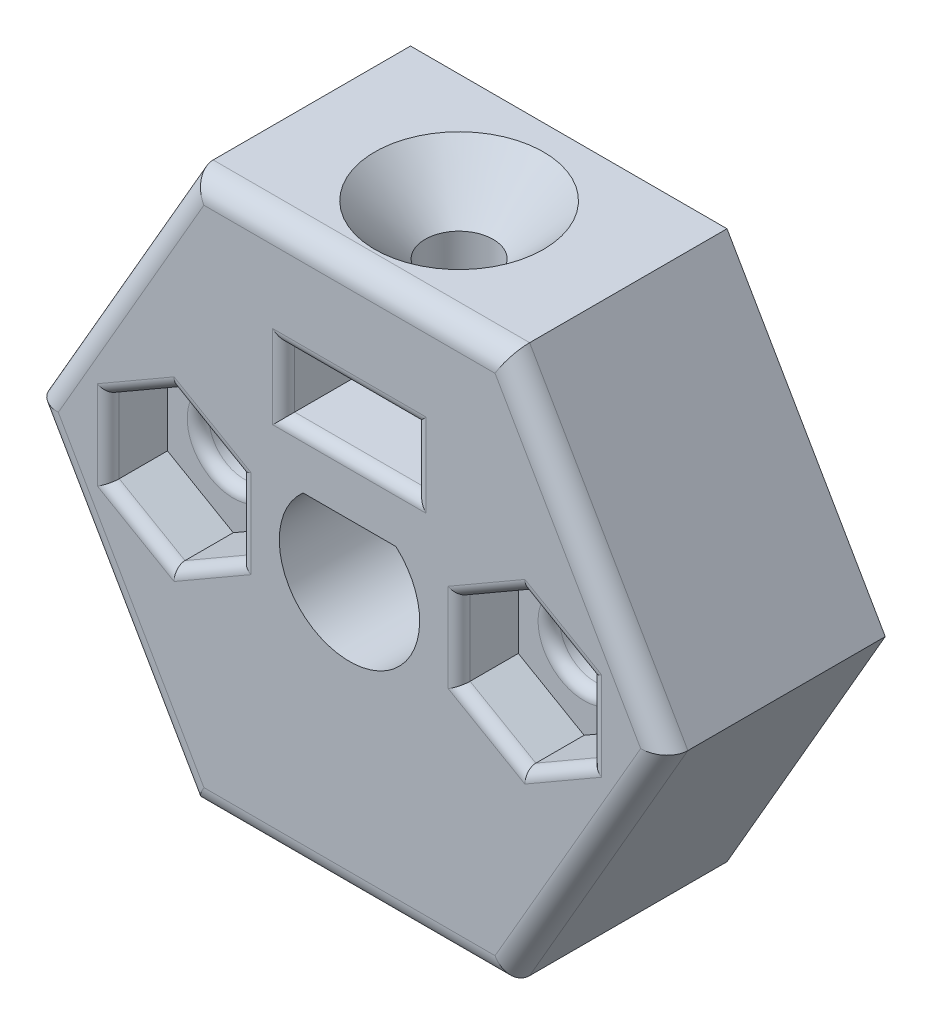
from build123d import *

# Parameters (mm, degrees)
EXTRUDE_1_DEPTH     = 10
CUT_EXTRUDE_1_DEPTH = 22.554195261
SKETCH_3_R          = 1.55
CUT_EXTRUDE_2_DEPTH = 10.1
CHAMFER_1_SIZE      = 2.3
SKETCH_4_W          = 6
SKETCH_4_H          = 2.8
CUT_EXTRUDE_3_DEPTH = 8.5
FILLET_1_R          = 1
CUT_EXTRUDE_4_DEPTH = 2.7
SKETCH_6_R          = 1.6
CUT_EXTRUDE_5_DEPTH = 7.3
FILLET_2_R          = 0.5


with BuildPart() as part:
    # Эскиз1 → Бобышка-Вытянуть1 (new body)
    with BuildSketch(Plane.XY):
        Polygon((7.216878365, -12.5), (14.43375673, 0), (7.216878365, 12.5), (-7.216878365, 12.5), (-14.43375673, 0), (-7.216878365, -12.5), align=None)
    extrude(amount=EXTRUDE_1_DEPTH)

    # Эскиз2 → Вырез-Вытянуть1 (cut, through all)
    with BuildSketch(Plane.XY.offset(10)):
        with BuildLine():
            Line((-2.116601049, 2.4), (2.116601049, 2.4))
            ThreePointArc((2.116601049, 2.4), (0, -3.2), (-2.116601049, 2.4))
        make_face()
    extrude(amount=-CUT_EXTRUDE_1_DEPTH, mode=Mode.SUBTRACT)

    # Эскиз3 → Вырез-Вытянуть2 (cut)
    with BuildSketch(Plane.XZ.offset(-2.4)):
        with Locations(Location((0, 5, 0), (0, 0, 270))):
            Circle(SKETCH_3_R)
    extrude(amount=-CUT_EXTRUDE_2_DEPTH, mode=Mode.SUBTRACT)

    # Фаска1
    chamfer_1_edges = [part.edges().sort_by_distance(p)[0] for p in [
        (0, 12.5, 6.55),
    ]]
    chamfer(chamfer_1_edges, length=CHAMFER_1_SIZE)

    # Эскиз4 → Вырез-Вытянуть3 (cut)
    with BuildSketch(Plane.XY.offset(10)):
        with Locations((0, 6.3)):
            Rectangle(SKETCH_4_W, SKETCH_4_H)
    extrude(amount=-CUT_EXTRUDE_3_DEPTH, mode=Mode.SUBTRACT)

    # Скругление1
    fillet_1_edges = [part.edges().sort_by_distance(p)[0] for p in [
        (10.825317547, 6.25, 10),
        (0, 12.5, 10),
        (-10.825317547, 6.25, 10),
        (-10.825317547, -6.25, 10),
        (0, -12.5, 10),
        (10.825317547, -6.25, 10),
    ]]
    fillet(fillet_1_edges, radius=FILLET_1_R)

    # Эскиз5 → Вырез-Вытянуть4 (cut)
    with BuildSketch(Plane.XY.offset(10)):
        Polygon((-11, -1.732050808), (-8, -3.464101615), (-5, -1.732050808), (-5, 1.732050808), (-8, 3.464101615), (-11, 1.732050808), align=None)
        Polygon((8, -3.464101615), (5, -1.732050808), (5, 1.732050808), (8, 3.464101615), (11, 1.732050808), (11, -1.732050808), align=None)
    extrude(amount=-CUT_EXTRUDE_4_DEPTH, mode=Mode.SUBTRACT)

    # Эскиз6 → Вырез-Вытянуть5 (cut)
    with BuildSketch(Plane.XY.offset(7.3)):
        with Locations((-8, 0)):
            Circle(SKETCH_6_R)
        with Locations((8, 0)):
            Circle(SKETCH_6_R)
    extrude(amount=-CUT_EXTRUDE_5_DEPTH, mode=Mode.SUBTRACT)

    # Скругление2
    fillet_2_edges = [part.edges().sort_by_distance(p)[0] for p in [
        (-9.6, 0, 7.3),
        (6.4, 0, 7.3),
        (3, 6.3, 10),
        (0, 7.7, 10),
        (-3, 6.3, 10),
        (0, 4.9, 10),
        (9.5, -2.598076211, 10),
        (11, 0, 10),
        (9.5, 2.598076211, 10),
        (6.5, 2.598076211, 10),
        (5, 0, 10),
        (6.5, -2.598076211, 10),
        (-11, 0, 10),
        (-9.5, -2.598076211, 10),
        (-6.5, -2.598076211, 10),
        (-5, 0, 10),
        (-6.5, 2.598076211, 10),
        (-9.5, 2.598076211, 10),
    ]]
    fillet(fillet_2_edges, radius=FILLET_2_R)


solid = part.part
